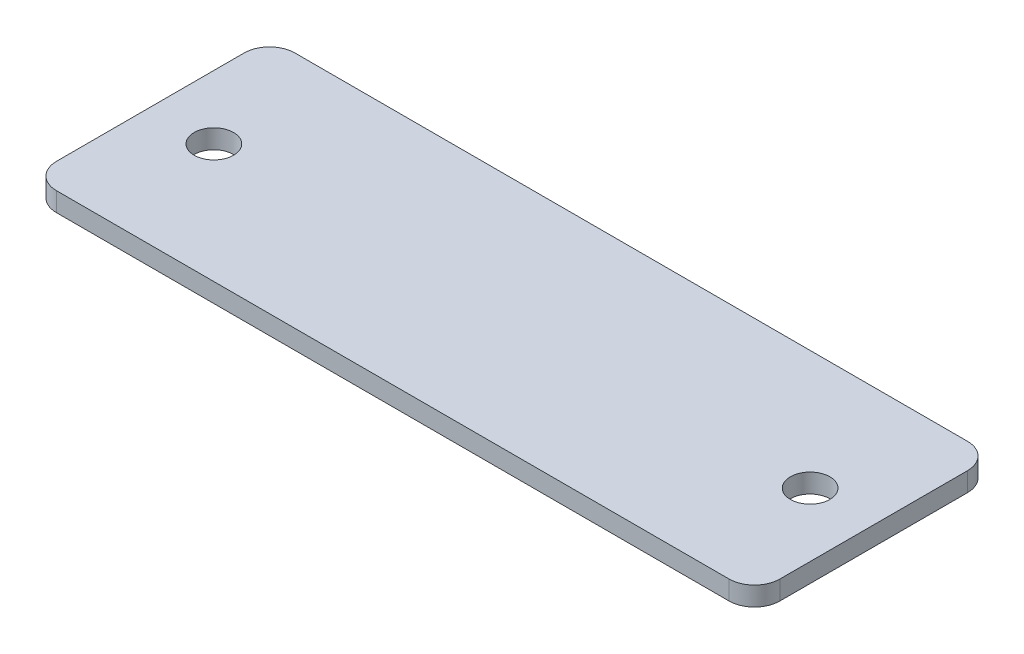
from build123d import *

# Parameters (mm, degrees)
SKETCH1_W           = 56.875
SKETCH1_H           = 18.75
BOSS_EXTRUDE1_DEPTH = 1.5
FILLET1_R           = 2
SKETCH2_R           = 1.55
CUT_EXTRUDE1_DEPTH  = 1.5


with BuildPart() as part:
    # Sketch1 → Boss-Extrude1 (new body)
    with BuildSketch(Plane(origin=(0, 0, 0), x_dir=(1, 0, 0), z_dir=(0, 1, 0))):
        Rectangle(SKETCH1_W, SKETCH1_H)
    extrude(amount=BOSS_EXTRUDE1_DEPTH)

    # Fillet1
    fillet1_edges = [part.edges().sort_by_distance(p)[0] for p in [
        (28.4375, 0.75, 9.375),
        (-28.4375, 0.75, 9.375),
        (-28.4375, 0.75, -9.375),
        (28.4375, 0.75, -9.375),
    ]]
    fillet(fillet1_edges, radius=FILLET1_R)

    # Sketch2 → Cut-Extrude1 (cut)
    with BuildSketch(Plane(origin=(0, 1.5, 0), x_dir=(1, 0, 0), z_dir=(0, 1, 0))):
        with Locations(Location((-23.4375, 0, 0), (0, 0, 270))):
            Circle(SKETCH2_R)
        with Locations(Location((23.4375, 0, 0), (0, 0, 270))):
            Circle(SKETCH2_R)
    extrude(amount=-CUT_EXTRUDE1_DEPTH, mode=Mode.SUBTRACT)


solid = part.part
